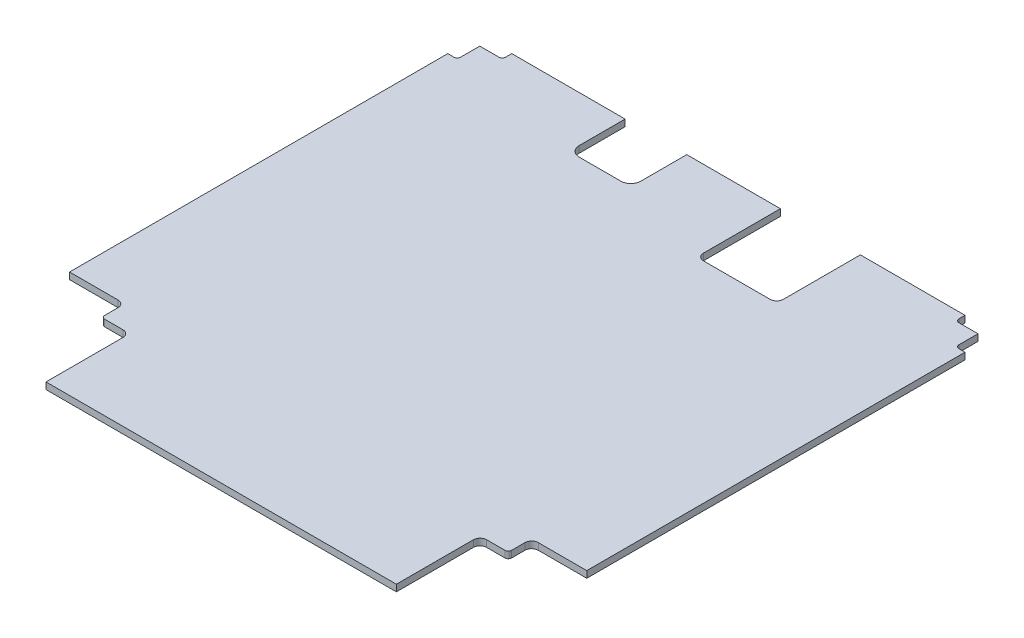
from build123d import *

# Parameters (mm, degrees)
SKETCH1_W           = 340
SKETCH1_H           = 340
BOSS_EXTRUDE1_DEPTH = 4
CUT_EXTRUDE1_DEPTH  = 10
CUT_EXTRUDE2_DEPTH  = 10
CUT_EXTRUDE3_DEPTH  = 10
CUT_EXTRUDE4_DEPTH  = 10
FILLET1_R           = 2
SKETCH6_W           = 392.3816867
SKETCH6_H           = 384.263444906
SKETCH6_W_2         = 310.4
SKETCH6_H_2         = 310.4
CUT_EXTRUDE5_DEPTH  = 10


with BuildPart() as part:
    # Sketch1 → Boss-Extrude1 (new body)
    with BuildSketch(Plane(origin=(0, 0, 0), x_dir=(1, 0, 0), z_dir=(0, 1, 0))):
        Rectangle(SKETCH1_W, SKETCH1_H)
    extrude(amount=BOSS_EXTRUDE1_DEPTH)

    # Sketch2 → Cut-Extrude1 (cut)
    with BuildSketch(Plane.XZ):
        with BuildLine():
            Line((-66.986059773, -127.64), (-66.986059773, -170))
            Line((-66.986059773, -170), (-31.986059773, -170))
            Line((-31.986059773, -170), (-31.986059773, -127.64))
            ThreePointArc((-31.986059773, -127.64), (-33.450525867, -124.104466094), (-36.986059773, -122.64))
            Line((-36.986059773, -122.64), (-61.986059773, -122.64))
            ThreePointArc((-61.986059773, -122.64), (-65.521593679, -124.104466094), (-66.986059773, -127.64))
        make_face()
        with BuildLine():
            Line((-67.986059773, -170), (-66.986059773, -170))
            Line((-66.986059773, -170), (-66.986059773, -127.64))
            ThreePointArc((-66.986059773, -127.64), (-65.521593679, -124.104466094), (-61.986059773, -122.64))
            Line((-61.986059773, -122.64), (-36.986059773, -122.64))
            ThreePointArc((-36.986059773, -122.64), (-33.450525867, -124.104466094), (-31.986059773, -127.64))
            Line((-31.986059773, -127.64), (-31.986059773, -170))
            Line((-31.986059773, -170), (-30.986059773, -170))
            Line((-30.986059773, -170), (-30.986059773, -127.64))
            ThreePointArc((-30.986059773, -127.64), (-32.743419086, -123.397359313), (-36.986059773, -121.64))
            Line((-36.986059773, -121.64), (-61.986059773, -121.64))
            ThreePointArc((-61.986059773, -121.64), (-66.22870046, -123.397359313), (-67.986059773, -127.64))
            Line((-67.986059773, -127.64), (-67.986059773, -170))
        make_face()
    extrude(amount=-CUT_EXTRUDE1_DEPTH, mode=Mode.SUBTRACT)

    # Sketch3 → Cut-Extrude2 (cut)
    with BuildSketch(Plane.XZ):
        with BuildLine():
            Line((-170, 170), (-170, 100.75796452))
            Line((-170, 100.75796452), (-155.526912903, 92.401923789))
            ThreePointArc((-155.526912903, 92.401923789), (-154.803370039, 92.102222521), (-154.026912903, 92))
            Line((-154.026912903, 92), (-126.103320198, 92))
            ThreePointArc((-126.103320198, 92), (-123.981999855, 92.878679656), (-123.103320198, 95))
            Line((-123.103320198, 95), (-123.103320198, 103))
            ThreePointArc((-123.103320198, 103), (-122.224640542, 105.121320344), (-120.103320198, 106))
            Line((-120.103320198, 106), (-109.14, 106))
            ThreePointArc((-109.14, 106), (-107.018679656, 106.878679656), (-106.14, 109))
            Line((-106.14, 109), (-106.14, 148))
            Line((-106.14, 148), (-110.172231068, 170))
            Line((-110.172231068, 170), (-170, 170))
        make_face()
        with BuildLine():
            Line((-155.526912903, 92.401923789), (-170, 100.75796452))
            Line((-170, 100.75796452), (-170, 91))
            Line((-170, 91), (-154.026912903, 91))
            Line((-154.026912903, 91), (-126.103320198, 91))
            ThreePointArc((-126.103320198, 91), (-123.274893074, 92.171572875), (-122.103320198, 95))
            Line((-122.103320198, 95), (-122.103320198, 103))
            ThreePointArc((-122.103320198, 103), (-121.517533761, 104.414213562), (-120.103320198, 105))
            Line((-120.103320198, 105), (-109.14, 105))
            ThreePointArc((-109.14, 105), (-106.311572875, 106.171572875), (-105.14, 109))
            Line((-105.14, 109), (-105.14, 148.090884654))
            Line((-105.14, 148.090884654), (-105.14, 170))
            Line((-105.14, 170), (-110.172231068, 170))
            Line((-110.172231068, 170), (-106.14, 148))
            Line((-106.14, 148), (-106.14, 109))
            ThreePointArc((-106.14, 109), (-107.018679656, 106.878679656), (-109.14, 106))
            Line((-109.14, 106), (-120.103320198, 106))
            ThreePointArc((-120.103320198, 106), (-122.224640542, 105.121320344), (-123.103320198, 103))
            Line((-123.103320198, 103), (-123.103320198, 95))
            ThreePointArc((-123.103320198, 95), (-123.981999855, 92.878679656), (-126.103320198, 92))
            Line((-126.103320198, 92), (-154.026912903, 92))
            ThreePointArc((-154.026912903, 92), (-154.803370039, 92.102222521), (-155.526912903, 92.401923789))
        make_face()
    cut_extrude2 = extrude(amount=-CUT_EXTRUDE2_DEPTH, mode=Mode.SUBTRACT)

    # Mirror1: Cut-Extrude2 across plane
    add(cut_extrude2.mirror(Plane(origin=(0, 0, 0), x_dir=(0, 0, 1), z_dir=(1, 0, 0))), mode=Mode.SUBTRACT)

    # Sketch4 → Cut-Extrude3 (cut)
    with BuildSketch(Plane.XZ):
        with BuildLine():
            Line((26.206059773, -109), (26.206059773, -170))
            Line((26.206059773, -170), (72.206059773, -170))
            Line((72.206059773, -170), (72.206059773, -109))
            ThreePointArc((72.206059773, -109), (71.327380117, -106.878679656), (69.206059773, -106))
            Line((69.206059773, -106), (29.206059773, -106))
            ThreePointArc((29.206059773, -106), (27.08473943, -106.878679656), (26.206059773, -109))
        make_face()
        with BuildLine():
            Line((25.206059773, -170), (26.206059773, -170))
            Line((26.206059773, -170), (26.206059773, -109))
            ThreePointArc((26.206059773, -109), (27.08473943, -106.878679656), (29.206059773, -106))
            Line((29.206059773, -106), (69.206059773, -106))
            ThreePointArc((69.206059773, -106), (71.327380117, -106.878679656), (72.206059773, -109))
            Line((72.206059773, -109), (72.206059773, -170))
            Line((72.206059773, -170), (73.206059773, -170))
            Line((73.206059773, -170), (73.206059773, -109))
            ThreePointArc((73.206059773, -109), (72.034486898, -106.171572875), (69.206059773, -105))
            Line((69.206059773, -105), (29.206059773, -105))
            ThreePointArc((29.206059773, -105), (26.377632649, -106.171572875), (25.206059773, -109))
            Line((25.206059773, -109), (25.206059773, -170))
        make_face()
    extrude(amount=-CUT_EXTRUDE3_DEPTH, mode=Mode.SUBTRACT)

    # Sketch5 → Cut-Extrude4 (cut)
    with BuildSketch(Plane.XZ):
        Polygon((136, -170), (136, -149.5), (149.5, -149.5), (149.5, -136), (170, -136), (170, -170), align=None)
        Polygon((-170, -136), (-149.5, -136), (-149.5, -149.5), (-136, -149.5), (-136, -170), (-170, -170), align=None)
    extrude(amount=-CUT_EXTRUDE4_DEPTH, mode=Mode.SUBTRACT)

    # Fillet1
    fillet1_edges = [part.edges().sort_by_distance(p)[0] for p in [
        (136, 2, -149.5),
        (149.5, 2, -136),
        (-149.5, 2, -136),
        (-136, 2, -149.5),
    ]]
    fillet(fillet1_edges, radius=FILLET1_R)

    # Sketch6 → Cut-Extrude5 (cut)
    with BuildSketch(Plane(origin=(0, 0, 0), x_dir=(1, 0, 0), z_dir=(0, 1, 0))):
        Rectangle(SKETCH6_W, SKETCH6_H)
        Rectangle(SKETCH6_W_2, SKETCH6_H_2, mode=Mode.SUBTRACT)
    extrude(amount=CUT_EXTRUDE5_DEPTH, mode=Mode.SUBTRACT)


solid = part.part
